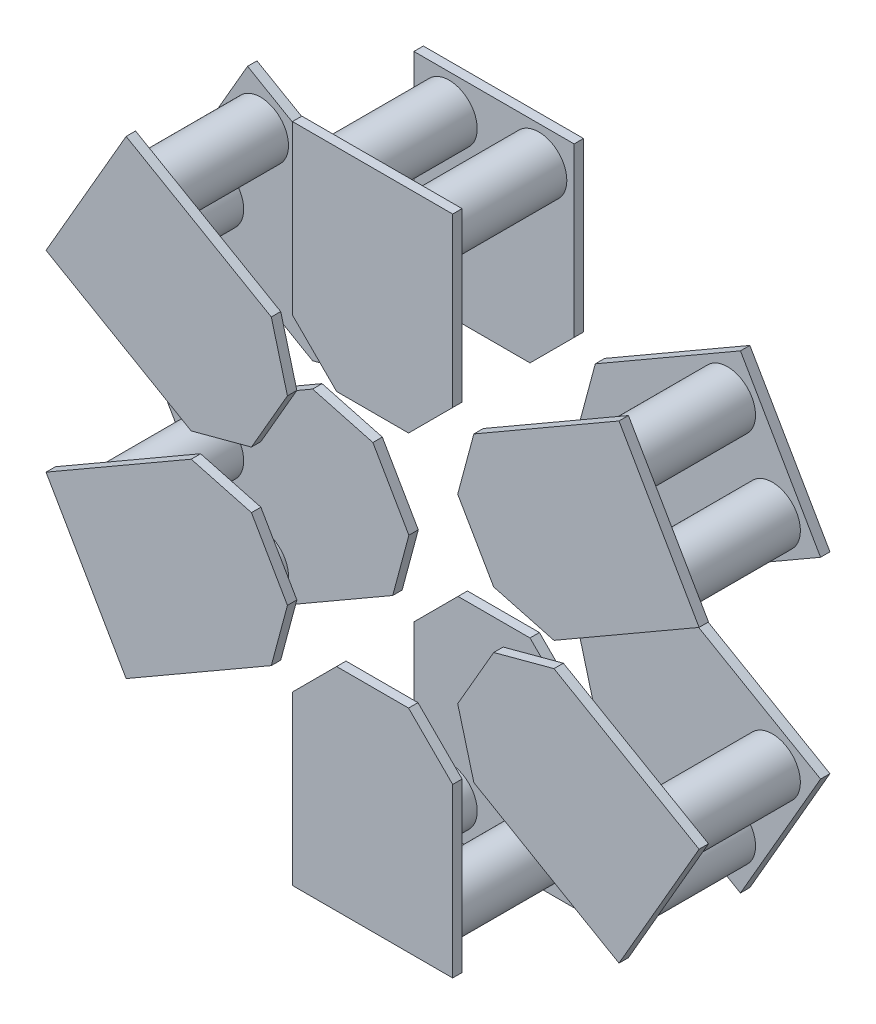
from build123d import *

# Parameters (mm, degrees)
SKETCH2_R               = 3.175
BOSS_EXTRUDE1_DEPTH     = 12.7
BOSS_EXTRUDE1_2_DEPTH   = 12.7
SKETCH3_W               = 18.16
SKETCH3_H               = 24
BOSS_EXTRUDE2_DEPTH     = 1.0668
CHAMFER1_SIZE           = 5
CHAMFER2_SIZE           = 5
CIRPATTERN1_COUNT       = 6
CUT_EXTRUDE1_DEPTH      = 78.162098323
CUT_EXTRUDE1_DEPTH_BACK = 78.162098323
SKETCH6_OUTSIDE_W       = 92.808
SKETCH6_OUTSIDE_H       = 93.24
CIRPATTERN2_COUNT       = 6


with BuildPart() as part:
    # Sketch2 → Boss-Extrude1 (new body)
    with BuildSketch(Plane.XY):
        with Locations((5.08, 0)):
            Circle(SKETCH2_R)
    extrude(amount=BOSS_EXTRUDE1_DEPTH)


with BuildPart() as body_2:
    # Sketch2 → Boss-Extrude1 2 (new body)
    with BuildSketch(Plane.XY):
        with Locations((-5.08, 0)):
            Circle(SKETCH2_R)
    extrude(amount=BOSS_EXTRUDE1_2_DEPTH)


with BuildPart() as body_3:
    # Sketch3 → Boss-Extrude2 (new body)
    with BuildSketch(Plane.XY.offset(12.7)):
        with Locations((0, -8)):
            Rectangle(SKETCH3_W, SKETCH3_H)
    extrude(amount=BOSS_EXTRUDE2_DEPTH)


with BuildPart() as body_4:
    # Mirror1: mirrored copy
    add(body_3.part.mirror(Plane.XY.offset(6.35)))

    # Chamfer2
    chamfer2_edges = [body_4.edges().sort_by_distance(p)[0] for p in [
        (9.08, -20, -0.5334),
        (-9.08, -20, -0.5334),
    ]]
    chamfer(chamfer2_edges, length=CHAMFER2_SIZE)


with BuildPart() as body_3_1:
    add(body_3.part)

    # Chamfer1
    chamfer1_edges = [body_3_1.edges().sort_by_distance(p)[0] for p in [
        (9.08, -20, 13.2334),
        (-9.08, -20, 13.2334),
    ]]
    chamfer(chamfer1_edges, length=CHAMFER1_SIZE)


with BuildPart() as cirpattern1_1:
    # CirPattern1: pattern copy
    add(body_4.part.rotate(Axis((0, -31.5, 0), (0, 0, 1)), 1 * 360 / CIRPATTERN1_COUNT))


with BuildPart() as cirpattern1_2:
    # CirPattern1: pattern copy
    add(body_4.part.rotate(Axis((0, -31.5, 0), (0, 0, 1)), 2 * 360 / CIRPATTERN1_COUNT))


with BuildPart() as cirpattern1_3:
    # CirPattern1: pattern copy
    add(body_4.part.rotate(Axis((0, -31.5, 0), (0, 0, 1)), 3 * 360 / CIRPATTERN1_COUNT))


with BuildPart() as cirpattern1_4:
    # CirPattern1: pattern copy
    add(body_4.part.rotate(Axis((0, -31.5, 0), (0, 0, 1)), 4 * 360 / CIRPATTERN1_COUNT))


with BuildPart() as cirpattern1_5:
    # CirPattern1: pattern copy
    add(body_4.part.rotate(Axis((0, -31.5, 0), (0, 0, 1)), 5 * 360 / CIRPATTERN1_COUNT))


with BuildPart() as cirpattern1_6:
    # CirPattern1: pattern copy
    add(body_2.part.rotate(Axis((0, -31.5, 0), (0, 0, 1)), 1 * 360 / CIRPATTERN1_COUNT))


with BuildPart() as cirpattern1_7:
    # CirPattern1: pattern copy
    add(body_2.part.rotate(Axis((0, -31.5, 0), (0, 0, 1)), 2 * 360 / CIRPATTERN1_COUNT))


with BuildPart() as cirpattern1_8:
    # CirPattern1: pattern copy
    add(body_2.part.rotate(Axis((0, -31.5, 0), (0, 0, 1)), 3 * 360 / CIRPATTERN1_COUNT))


with BuildPart() as cirpattern1_9:
    # CirPattern1: pattern copy
    add(body_2.part.rotate(Axis((0, -31.5, 0), (0, 0, 1)), 4 * 360 / CIRPATTERN1_COUNT))


with BuildPart() as cirpattern1_10:
    # CirPattern1: pattern copy
    add(body_2.part.rotate(Axis((0, -31.5, 0), (0, 0, 1)), 5 * 360 / CIRPATTERN1_COUNT))


with BuildPart() as cirpattern1_11:
    # CirPattern1: pattern copy
    add(part.part.rotate(Axis((0, -31.5, 0), (0, 0, 1)), 1 * 360 / CIRPATTERN1_COUNT))


with BuildPart() as cirpattern1_12:
    # CirPattern1: pattern copy
    add(part.part.rotate(Axis((0, -31.5, 0), (0, 0, 1)), 2 * 360 / CIRPATTERN1_COUNT))


with BuildPart() as cirpattern1_13:
    # CirPattern1: pattern copy
    add(part.part.rotate(Axis((0, -31.5, 0), (0, 0, 1)), 3 * 360 / CIRPATTERN1_COUNT))


with BuildPart() as cirpattern1_14:
    # CirPattern1: pattern copy
    add(part.part.rotate(Axis((0, -31.5, 0), (0, 0, 1)), 4 * 360 / CIRPATTERN1_COUNT))


with BuildPart() as cirpattern1_15:
    # CirPattern1: pattern copy
    add(part.part.rotate(Axis((0, -31.5, 0), (0, 0, 1)), 5 * 360 / CIRPATTERN1_COUNT))


with BuildPart() as cirpattern1_16:
    # CirPattern1: pattern copy
    add(body_3_1.part.rotate(Axis((0, -31.5, 0), (0, 0, 1)), 1 * 360 / CIRPATTERN1_COUNT))


with BuildPart() as cirpattern1_17:
    # CirPattern1: pattern copy
    add(body_3_1.part.rotate(Axis((0, -31.5, 0), (0, 0, 1)), 2 * 360 / CIRPATTERN1_COUNT))


with BuildPart() as cirpattern1_18:
    # CirPattern1: pattern copy
    add(body_3_1.part.rotate(Axis((0, -31.5, 0), (0, 0, 1)), 3 * 360 / CIRPATTERN1_COUNT))


with BuildPart() as cirpattern1_19:
    # CirPattern1: pattern copy
    add(body_3_1.part.rotate(Axis((0, -31.5, 0), (0, 0, 1)), 4 * 360 / CIRPATTERN1_COUNT))


with BuildPart() as cirpattern1_20:
    # CirPattern1: pattern copy
    add(body_3_1.part.rotate(Axis((0, -31.5, 0), (0, 0, 1)), 5 * 360 / CIRPATTERN1_COUNT))


with BuildPart() as cut_extrude1_tool:
    # Sketch6 outside → Cut-Extrude1 (new, two sides: drawn at the far end of the back side and taken through both)
    with BuildSketch(Plane.XY.offset(13.7668).offset(-CUT_EXTRUDE1_DEPTH_BACK)):
        with Locations((0, -31.5)):
            Rectangle(SKETCH6_OUTSIDE_W, SKETCH6_OUTSIDE_H)
        Polygon((1.83948581, -23.616489386), (14.058927261, -10.214521343), (10.905523015, 5.289716197), (-1.051134748, 8.574512286), (-14.650190557, 8.048944912), (-15.508351464, -0.082597257), (-10.051476032, -14.681844024), (-2.036573575, -23.616489386), align=None, mode=Mode.SUBTRACT)
    extrude(amount=CUT_EXTRUDE1_DEPTH + CUT_EXTRUDE1_DEPTH_BACK)


with BuildPart() as cirpattern1_1_1:
    add(cirpattern1_1.part)

    # Cut-Extrude1: cut by cut_extrude1_tool
    add(cut_extrude1_tool.part, mode=Mode.SUBTRACT)


with BuildPart() as cirpattern1_2_1:
    add(cirpattern1_2.part)

    # Cut-Extrude1: cut by cut_extrude1_tool
    add(cut_extrude1_tool.part, mode=Mode.SUBTRACT)


with BuildPart() as cirpattern1_3_1:
    add(cirpattern1_3.part)

    # Cut-Extrude1: cut by cut_extrude1_tool
    add(cut_extrude1_tool.part, mode=Mode.SUBTRACT)


with BuildPart() as cirpattern1_4_1:
    add(cirpattern1_4.part)

    # Cut-Extrude1: cut by cut_extrude1_tool
    add(cut_extrude1_tool.part, mode=Mode.SUBTRACT)


with BuildPart() as cirpattern1_5_1:
    add(cirpattern1_5.part)

    # Cut-Extrude1: cut by cut_extrude1_tool
    add(cut_extrude1_tool.part, mode=Mode.SUBTRACT)


with BuildPart() as cirpattern1_6_1:
    add(cirpattern1_6.part)

    # Cut-Extrude1: cut by cut_extrude1_tool
    add(cut_extrude1_tool.part, mode=Mode.SUBTRACT)


with BuildPart() as cirpattern1_7_1:
    add(cirpattern1_7.part)

    # Cut-Extrude1: cut by cut_extrude1_tool
    add(cut_extrude1_tool.part, mode=Mode.SUBTRACT)


with BuildPart() as cirpattern1_8_1:
    add(cirpattern1_8.part)

    # Cut-Extrude1: cut by cut_extrude1_tool
    add(cut_extrude1_tool.part, mode=Mode.SUBTRACT)


with BuildPart() as cirpattern1_9_1:
    add(cirpattern1_9.part)

    # Cut-Extrude1: cut by cut_extrude1_tool
    add(cut_extrude1_tool.part, mode=Mode.SUBTRACT)


with BuildPart() as cirpattern1_10_1:
    add(cirpattern1_10.part)

    # Cut-Extrude1: cut by cut_extrude1_tool
    add(cut_extrude1_tool.part, mode=Mode.SUBTRACT)


with BuildPart() as cirpattern1_11_1:
    add(cirpattern1_11.part)

    # Cut-Extrude1: cut by cut_extrude1_tool
    add(cut_extrude1_tool.part, mode=Mode.SUBTRACT)


with BuildPart() as cirpattern1_12_1:
    add(cirpattern1_12.part)

    # Cut-Extrude1: cut by cut_extrude1_tool
    add(cut_extrude1_tool.part, mode=Mode.SUBTRACT)


with BuildPart() as cirpattern1_13_1:
    add(cirpattern1_13.part)

    # Cut-Extrude1: cut by cut_extrude1_tool
    add(cut_extrude1_tool.part, mode=Mode.SUBTRACT)


with BuildPart() as cirpattern1_14_1:
    add(cirpattern1_14.part)

    # Cut-Extrude1: cut by cut_extrude1_tool
    add(cut_extrude1_tool.part, mode=Mode.SUBTRACT)


with BuildPart() as cirpattern1_15_1:
    add(cirpattern1_15.part)

    # Cut-Extrude1: cut by cut_extrude1_tool
    add(cut_extrude1_tool.part, mode=Mode.SUBTRACT)


with BuildPart() as cirpattern1_16_1:
    add(cirpattern1_16.part)

    # Cut-Extrude1: cut by cut_extrude1_tool
    add(cut_extrude1_tool.part, mode=Mode.SUBTRACT)


with BuildPart() as cirpattern1_17_1:
    add(cirpattern1_17.part)

    # Cut-Extrude1: cut by cut_extrude1_tool
    add(cut_extrude1_tool.part, mode=Mode.SUBTRACT)


with BuildPart() as cirpattern1_18_1:
    add(cirpattern1_18.part)

    # Cut-Extrude1: cut by cut_extrude1_tool
    add(cut_extrude1_tool.part, mode=Mode.SUBTRACT)


with BuildPart() as cirpattern1_19_1:
    add(cirpattern1_19.part)

    # Cut-Extrude1: cut by cut_extrude1_tool
    add(cut_extrude1_tool.part, mode=Mode.SUBTRACT)


with BuildPart() as cirpattern1_20_1:
    add(cirpattern1_20.part)

    # Cut-Extrude1: cut by cut_extrude1_tool
    add(cut_extrude1_tool.part, mode=Mode.SUBTRACT)


with BuildPart() as cirpattern2_1:
    # CirPattern2: pattern copy
    add(body_2.part.rotate(Axis((0, -33.5, 13.7668), (0, 0, 1)), 1 * 360 / CIRPATTERN2_COUNT))


with BuildPart() as cirpattern2_2:
    # CirPattern2: pattern copy
    add(body_2.part.rotate(Axis((0, -33.5, 13.7668), (0, 0, 1)), 2 * 360 / CIRPATTERN2_COUNT))


with BuildPart() as cirpattern2_3:
    # CirPattern2: pattern copy
    add(body_2.part.rotate(Axis((0, -33.5, 13.7668), (0, 0, 1)), 3 * 360 / CIRPATTERN2_COUNT))


with BuildPart() as cirpattern2_4:
    # CirPattern2: pattern copy
    add(body_2.part.rotate(Axis((0, -33.5, 13.7668), (0, 0, 1)), 4 * 360 / CIRPATTERN2_COUNT))


with BuildPart() as cirpattern2_5:
    # CirPattern2: pattern copy
    add(body_2.part.rotate(Axis((0, -33.5, 13.7668), (0, 0, 1)), 5 * 360 / CIRPATTERN2_COUNT))


with BuildPart() as cirpattern2_6:
    # CirPattern2: pattern copy
    add(body_4.part.rotate(Axis((0, -33.5, 13.7668), (0, 0, 1)), 1 * 360 / CIRPATTERN2_COUNT))


with BuildPart() as cirpattern2_7:
    # CirPattern2: pattern copy
    add(body_4.part.rotate(Axis((0, -33.5, 13.7668), (0, 0, 1)), 2 * 360 / CIRPATTERN2_COUNT))


with BuildPart() as cirpattern2_8:
    # CirPattern2: pattern copy
    add(body_4.part.rotate(Axis((0, -33.5, 13.7668), (0, 0, 1)), 3 * 360 / CIRPATTERN2_COUNT))


with BuildPart() as cirpattern2_9:
    # CirPattern2: pattern copy
    add(body_4.part.rotate(Axis((0, -33.5, 13.7668), (0, 0, 1)), 4 * 360 / CIRPATTERN2_COUNT))


with BuildPart() as cirpattern2_10:
    # CirPattern2: pattern copy
    add(body_4.part.rotate(Axis((0, -33.5, 13.7668), (0, 0, 1)), 5 * 360 / CIRPATTERN2_COUNT))


with BuildPart() as cirpattern2_11:
    # CirPattern2: pattern copy
    add(part.part.rotate(Axis((0, -33.5, 13.7668), (0, 0, 1)), 1 * 360 / CIRPATTERN2_COUNT))


with BuildPart() as cirpattern2_12:
    # CirPattern2: pattern copy
    add(part.part.rotate(Axis((0, -33.5, 13.7668), (0, 0, 1)), 2 * 360 / CIRPATTERN2_COUNT))


with BuildPart() as cirpattern2_13:
    # CirPattern2: pattern copy
    add(part.part.rotate(Axis((0, -33.5, 13.7668), (0, 0, 1)), 3 * 360 / CIRPATTERN2_COUNT))


with BuildPart() as cirpattern2_14:
    # CirPattern2: pattern copy
    add(part.part.rotate(Axis((0, -33.5, 13.7668), (0, 0, 1)), 4 * 360 / CIRPATTERN2_COUNT))


with BuildPart() as cirpattern2_15:
    # CirPattern2: pattern copy
    add(part.part.rotate(Axis((0, -33.5, 13.7668), (0, 0, 1)), 5 * 360 / CIRPATTERN2_COUNT))


with BuildPart() as cirpattern2_16:
    # CirPattern2: pattern copy
    add(body_3_1.part.rotate(Axis((0, -33.5, 13.7668), (0, 0, 1)), 1 * 360 / CIRPATTERN2_COUNT))


with BuildPart() as cirpattern2_17:
    # CirPattern2: pattern copy
    add(body_3_1.part.rotate(Axis((0, -33.5, 13.7668), (0, 0, 1)), 2 * 360 / CIRPATTERN2_COUNT))


with BuildPart() as cirpattern2_18:
    # CirPattern2: pattern copy
    add(body_3_1.part.rotate(Axis((0, -33.5, 13.7668), (0, 0, 1)), 3 * 360 / CIRPATTERN2_COUNT))


with BuildPart() as cirpattern2_19:
    # CirPattern2: pattern copy
    add(body_3_1.part.rotate(Axis((0, -33.5, 13.7668), (0, 0, 1)), 4 * 360 / CIRPATTERN2_COUNT))


with BuildPart() as cirpattern2_20:
    # CirPattern2: pattern copy
    add(body_3_1.part.rotate(Axis((0, -33.5, 13.7668), (0, 0, 1)), 5 * 360 / CIRPATTERN2_COUNT))


solid = Compound([part.part, body_2.part, body_4.part, body_3_1.part, cirpattern2_1.part, cirpattern2_2.part, cirpattern2_3.part, cirpattern2_4.part, cirpattern2_5.part, cirpattern2_6.part, cirpattern2_7.part, cirpattern2_8.part, cirpattern2_9.part, cirpattern2_10.part, cirpattern2_11.part, cirpattern2_12.part, cirpattern2_13.part, cirpattern2_14.part, cirpattern2_15.part, cirpattern2_16.part, cirpattern2_17.part, cirpattern2_18.part, cirpattern2_19.part, cirpattern2_20.part])
